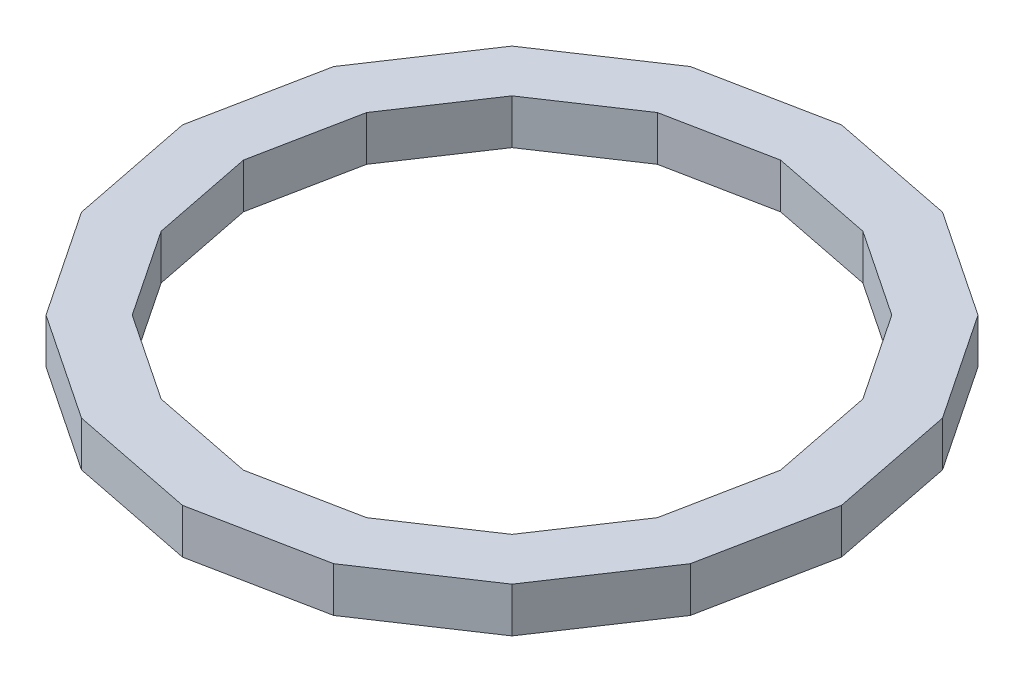
from build123d import *

# Parameters (mm, degrees)
BOSS_EXTRUDE1_DEPTH = 19.05


with BuildPart() as part:
    # Sketch1 → Boss-Extrude1 (new body)
    with BuildSketch(Plane(origin=(0, 0, 0), x_dir=(1, 0, 0), z_dir=(0, 1, 0))):
        Polygon((139.960812601, 0), (129.306930116, 53.560684163), (98.967239691, 98.967239691), (53.560684163, 129.306930116), (0, 139.960812601), (-53.560684163, 129.306930116), (-98.967239691, 98.967239691), (-129.306930116, 53.560684163), (-139.960812601, 0), (-129.306930116, -53.560684163), (-98.967239691, -98.967239691), (-53.560684163, -129.306930116), (0, -139.960812601), (53.560684163, -129.306930116), (98.967239691, -98.967239691), (129.306930116, -53.560684163), align=None)
        Polygon((114.063197183, 0), (105.38065329, 43.650095804), (80.654860212, 80.654860212), (43.650095804, 105.38065329), (0, 114.063197183), (-43.650095804, 105.38065329), (-80.654860212, 80.654860212), (-105.38065329, 43.650095804), (-114.063197183, 0), (-105.38065329, -43.650095804), (-80.654860212, -80.654860212), (-43.650095804, -105.38065329), (0, -114.063197183), (43.650095804, -105.38065329), (80.654860212, -80.654860212), (105.38065329, -43.650095804), align=None, mode=Mode.SUBTRACT)
    extrude(amount=BOSS_EXTRUDE1_DEPTH)


solid = part.part
